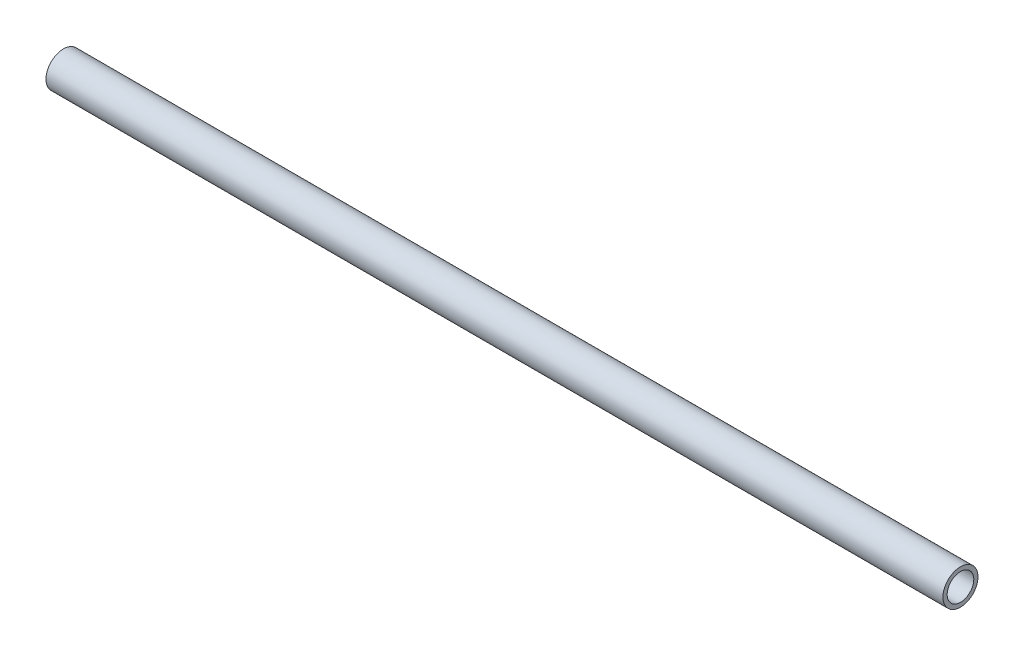
from build123d import *

# Parameters (mm, degrees)
SKETCH1_R           = 12.7
SKETCH1_R_2         = 9.652
BOSS_EXTRUDE1_DEPTH = 650


with BuildPart() as part:
    # Sketch1 → Boss-Extrude1 (new body)
    with BuildSketch(Plane(origin=(0, 0, 0), x_dir=(0, 0, -1), z_dir=(1, 0, 0))):
        Circle(SKETCH1_R)
        Circle(SKETCH1_R_2, mode=Mode.SUBTRACT)
    extrude(amount=BOSS_EXTRUDE1_DEPTH)


solid = part.part
